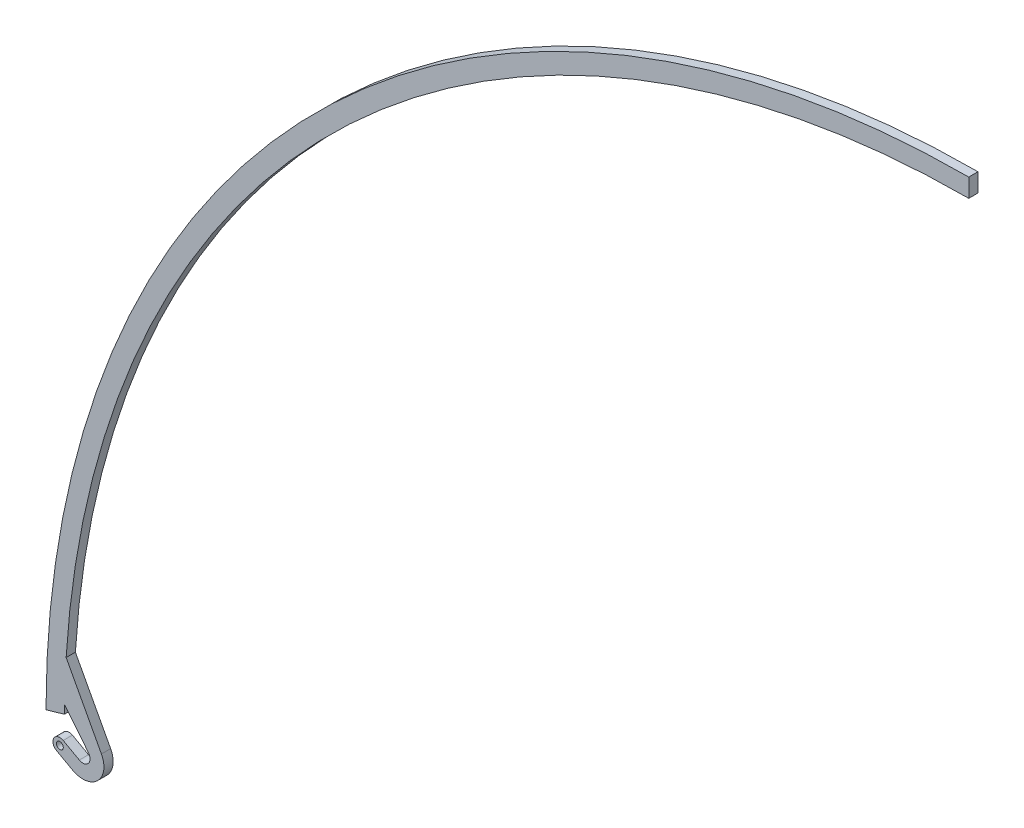
from build123d import *

# Parameters (mm, degrees)
SKETCH5_R           = 3.75
BOSS_EXTRUDE1_DEPTH = 5


with BuildPart() as part:
    # Sketch5 → Boss-Extrude1 (new, symmetric)
    with BuildSketch(Plane.XY):
        with BuildLine():
            Line((1000, 980), (1000, 1000))
            ThreePointArc((1000, 1000), (292.893218813, 707.106781187), (0, 0))
            Line((0, 0), (20.017296358, 5.822418881))
            ThreePointArc((20.017296358, 5.822418881), (20.055305468, 10.411323589), (20.114802643, 15))
            Line((20.114802643, 15), (46.029376088, -17.282126934))
            ThreePointArc((46.029376088, -17.282126934), (45.913408903, -27.269346828), (36.092525555, -29.08820907))
            Line((36.092525555, -29.08820907), (18.627898207, -19.435827958))
            ThreePointArc((18.627898207, -19.435827958), (8.435827958, -22.372101793), (11.372101793, -32.564172042))
            Line((11.372101793, -32.564172042), (28.836729142, -42.216553154))
            ThreePointArc((28.836729142, -42.216553154), (55.954267895, -38.481822572), (60.055964287, -11.417358652))
            Line((60.055964287, -11.417358652), (21.838459149, 60))
            ThreePointArc((21.838459149, 60), (328.583586736, 713.862731903), (1000, 980))
        make_face()
        with Locations((15, -26)):
            Circle(SKETCH5_R, mode=Mode.SUBTRACT)
    extrude(amount=BOSS_EXTRUDE1_DEPTH, both=True)


solid = part.part
